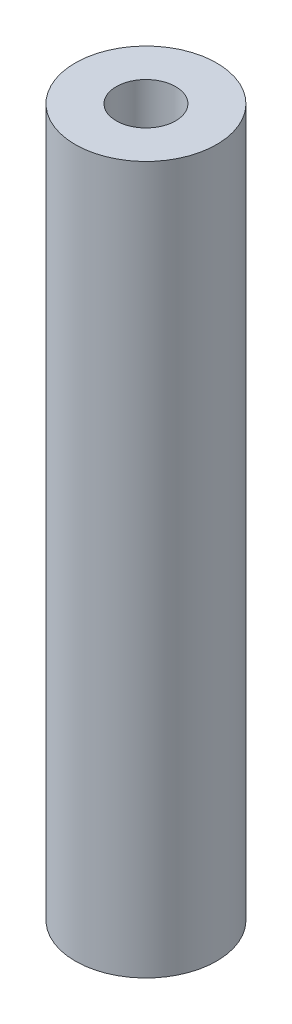
from build123d import *

# Parameters (mm, degrees)
SKETCH1_R           = 6.35
SKETCH1_R_2         = 2.667
BOSS_EXTRUDE1_DEPTH = 63.5


with BuildPart() as part:
    # Sketch1 → Boss-Extrude1 (new body)
    with BuildSketch(Plane(origin=(0, 0, 0), x_dir=(1, 0, 0), z_dir=(0, 1, 0))):
        Circle(SKETCH1_R)
        Circle(SKETCH1_R_2, mode=Mode.SUBTRACT)
    extrude(amount=BOSS_EXTRUDE1_DEPTH)


solid = part.part
